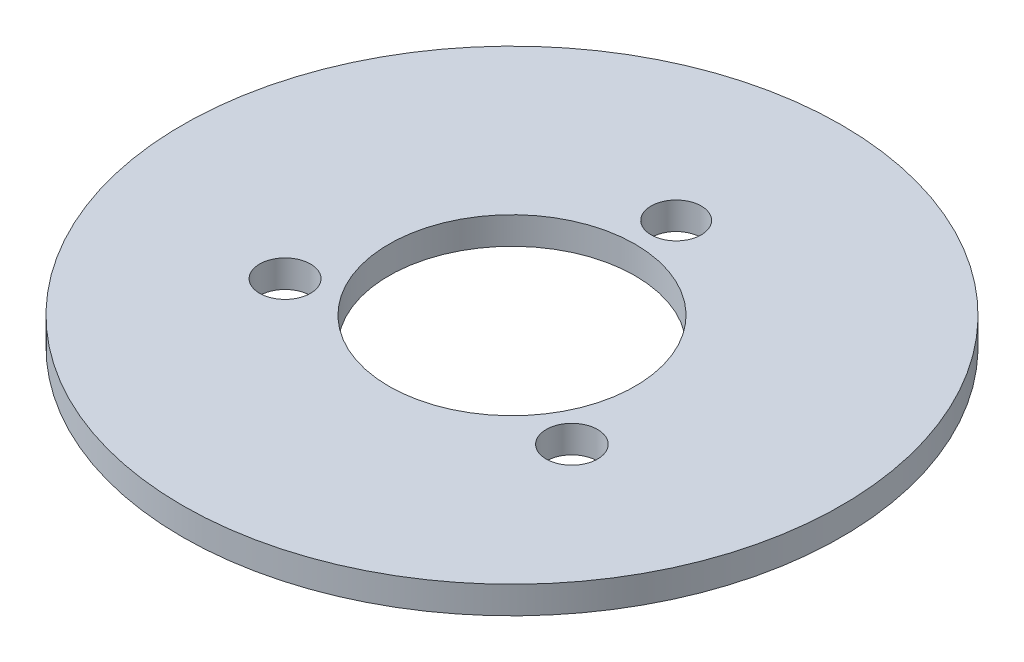
from build123d import *

# Parameters (mm, degrees)
SKETCH1_R           = 38.243875115
SKETCH1_R_2         = 12.860433797
SKETCH1_R_3         = 2.952880618
SKETCH1_R_4         = 2.979621757
SKETCH1_R_5         = 2.909102137
BOSS_EXTRUDE1_DEPTH = 3.175
SKETCH2_R           = 14.2875
CUT_EXTRUDE1_DEPTH  = 3.175


with BuildPart() as part:
    # Sketch1 → Boss-Extrude1 (new body)
    with BuildSketch(Plane(origin=(0, 0, 0), x_dir=(1, 0, 0), z_dir=(0, 1, 0))):
        with Locations(Location((0, 0, 0), (0, 0, 270))):
            Circle(SKETCH1_R)
        with Locations(Location((0, 0, 0), (0, 0, 270))):
            Circle(SKETCH1_R_2, mode=Mode.SUBTRACT)
        with Locations(Location((-16.841170726, -9.494245367, 0), (0, 0, 270))):
            Circle(SKETCH1_R_3, mode=Mode.SUBTRACT)
        with Locations(Location((16.444515355, -9.494245367, 0), (0, 0, 270))):
            Circle(SKETCH1_R_4, mode=Mode.SUBTRACT)
        with Locations(Location((0, 19.05, 0), (0, 0, 270))):
            Circle(SKETCH1_R_5, mode=Mode.SUBTRACT)
    extrude(amount=BOSS_EXTRUDE1_DEPTH)

    # Sketch2 → Cut-Extrude1 (cut)
    with BuildSketch(Plane.XZ):
        with Locations(Location((0, 0, 0), (0, 0, 270))):
            Circle(SKETCH2_R)
    extrude(amount=-CUT_EXTRUDE1_DEPTH, mode=Mode.SUBTRACT)


solid = part.part
